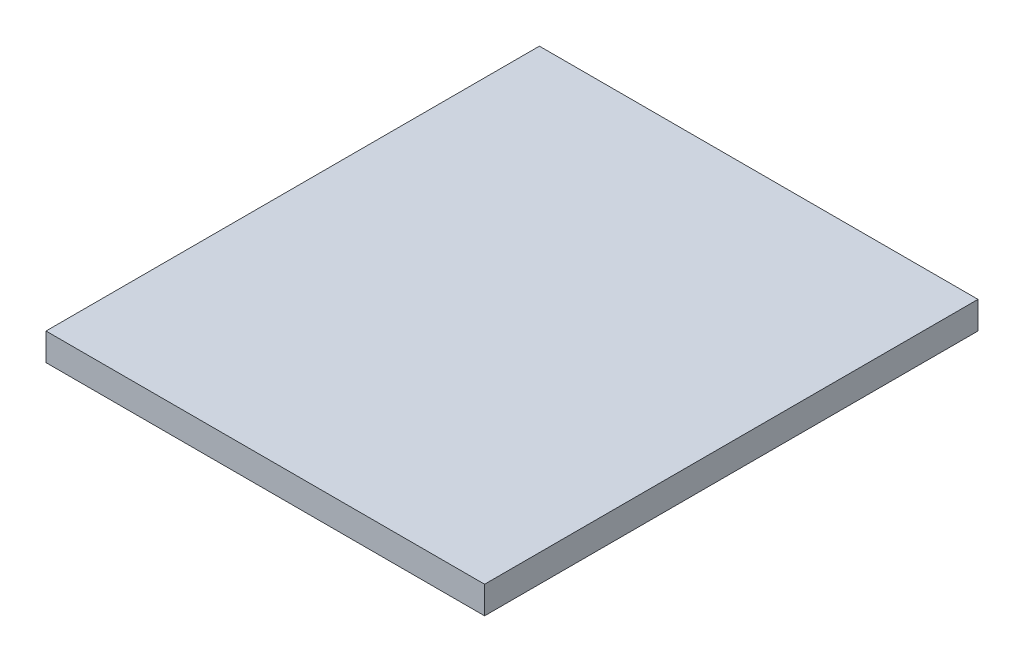
from build123d import *

# Parameters (mm, degrees)
SKETCH1_W           = 8
SKETCH1_H           = 9
BOSS_EXTRUDE1_DEPTH = 0.5


with BuildPart() as part:
    # Sketch1 → Boss-Extrude1 (new body)
    with BuildSketch(Plane(origin=(0, 0, 0), x_dir=(1, 0, 0), z_dir=(0, 1, 0))):
        Rectangle(SKETCH1_W, SKETCH1_H)
    extrude(amount=BOSS_EXTRUDE1_DEPTH)


solid = part.part
